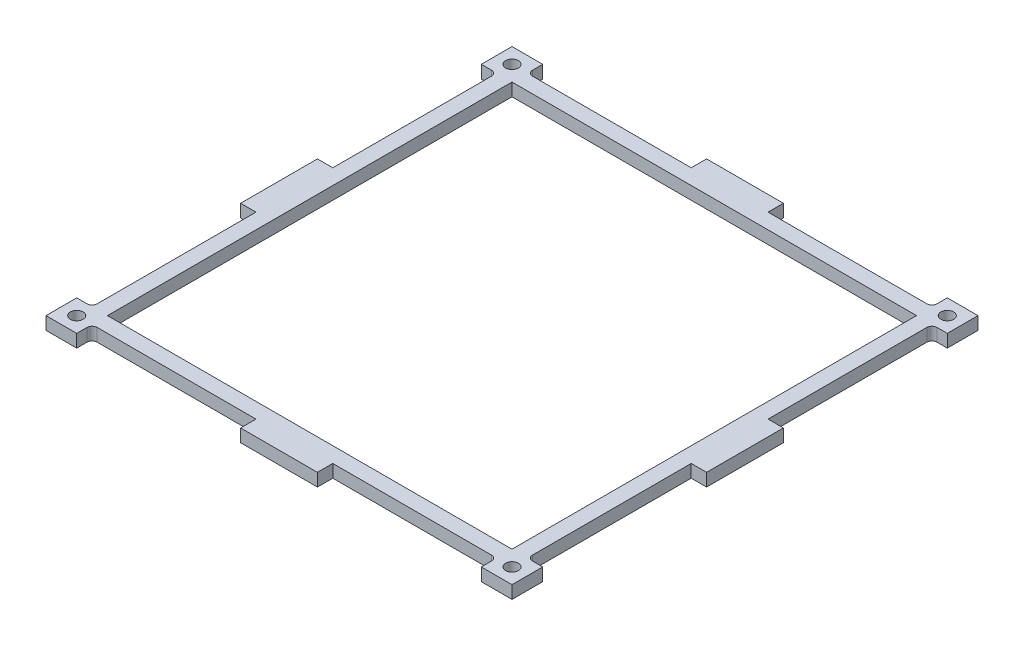
from build123d import *

# Parameters (mm, degrees)
CROQUIS1_R              = 2.5
SALIENTE_EXTRUIR1_DEPTH = 5
REDONDEO1_R             = 2


with BuildPart() as part:
    # Croquis1 → Saliente-Extruir1 (new body)
    # profile 1 of 4: a face of its own
    with BuildSketch(Plane(origin=(0, 0, 0), x_dir=(1, 0, 0), z_dir=(0, 1, 0))):
        Polygon((0, 79), (0, 91), (15, 91), (15, 85), (79, 85), (79, 91), (91, 91), (91, 79), (85, 79), (85, 15), (91, 15), (91, 0), (79, 0), (79, 79), align=None)
        with Locations(Location((85, 85, 0), (0, 0, 270))):
            Circle(CROQUIS1_R, mode=Mode.SUBTRACT)
    # profile 2 of 4: a face of its own
    with BuildSketch(Plane(origin=(0, 0, 0), x_dir=(1, 0, 0), z_dir=(0, 1, 0))):
        Polygon((79, 0), (91, 0), (91, -15), (85, -15), (85, -79), (91, -79), (91, -91), (79, -91), (79, -85), (15, -85), (15, -91), (0, -91), (0, -79), (79, -79), align=None)
        with Locations(Location((85, -85, 0), (0, 0, 270))):
            Circle(CROQUIS1_R, mode=Mode.SUBTRACT)
    # profile 3 of 4: a face of its own
    with BuildSketch(Plane(origin=(0, 0, 0), x_dir=(1, 0, 0), z_dir=(0, 1, 0))):
        Polygon((0, -79), (0, -91), (-15, -91), (-15, -85), (-79, -85), (-79, -91), (-91, -91), (-91, -79), (-85, -79), (-85, -15), (-91, -15), (-91, 0), (-79, 0), (-79, -79), align=None)
        with Locations(Location((-85, -85, 0), (0, 0, 270))):
            Circle(CROQUIS1_R, mode=Mode.SUBTRACT)
    # profile 4 of 4: a face of its own
    with BuildSketch(Plane(origin=(0, 0, 0), x_dir=(1, 0, 0), z_dir=(0, 1, 0))):
        Polygon((0, 79), (-79, 79), (-79, 0), (-91, 0), (-91, 15), (-85, 15), (-85, 79), (-91, 79), (-91, 91), (-79, 91), (-79, 85), (-15, 85), (-15, 91), (0, 91), align=None)
        with Locations(Location((-85, 85, 0), (0, 0, 270))):
            Circle(CROQUIS1_R, mode=Mode.SUBTRACT)
    extrude(amount=SALIENTE_EXTRUIR1_DEPTH)

    # Redondeo1
    redondeo1_edges = [part.edges().sort_by_distance(p)[0] for p in [
        (79, 2.5, -85),
        (85, 2.5, -79),
        (85, 2.5, 79),
        (79, 2.5, 85),
        (-79, 2.5, 85),
        (-85, 2.5, 79),
        (-85, 2.5, -79),
        (-79, 2.5, -85),
    ]]
    fillet(redondeo1_edges, radius=REDONDEO1_R)


solid = part.part
